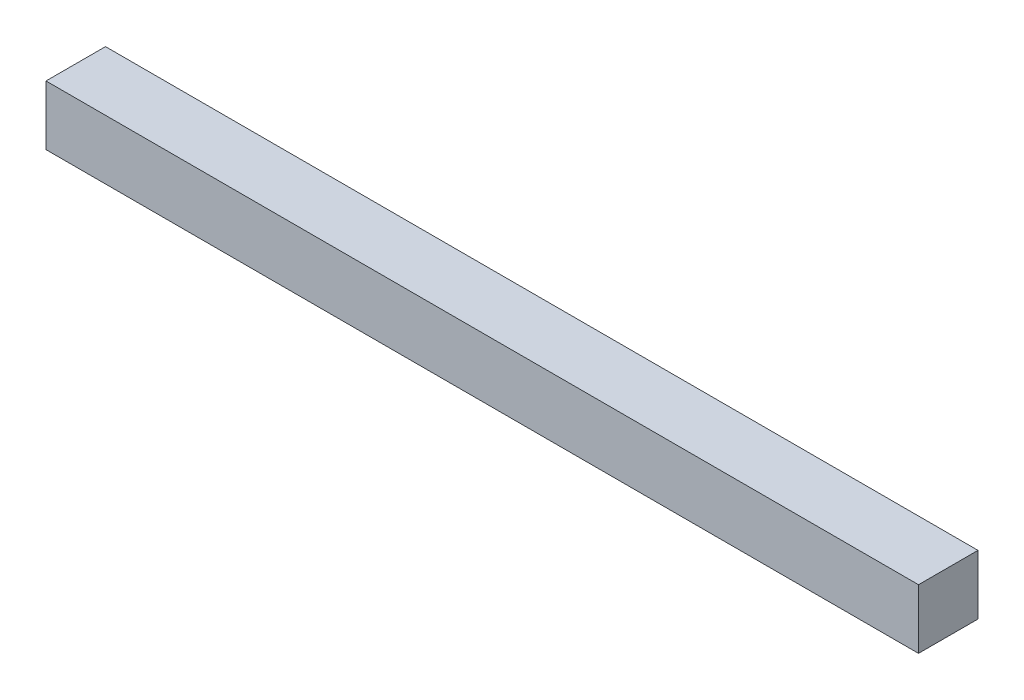
from build123d import *

# Parameters (mm, degrees)
SKETCH_1_W        = 2200
SKETCH_1_H        = 150
EXTRUDE_303_DEPTH = 150


with BuildPart() as part:
    # 草图1 → Extrude 303 (new body)
    with BuildSketch(Plane.XY):
        with Locations((1100, 75)):
            Rectangle(SKETCH_1_W, SKETCH_1_H)
    extrude(amount=EXTRUDE_303_DEPTH)


solid = part.part
